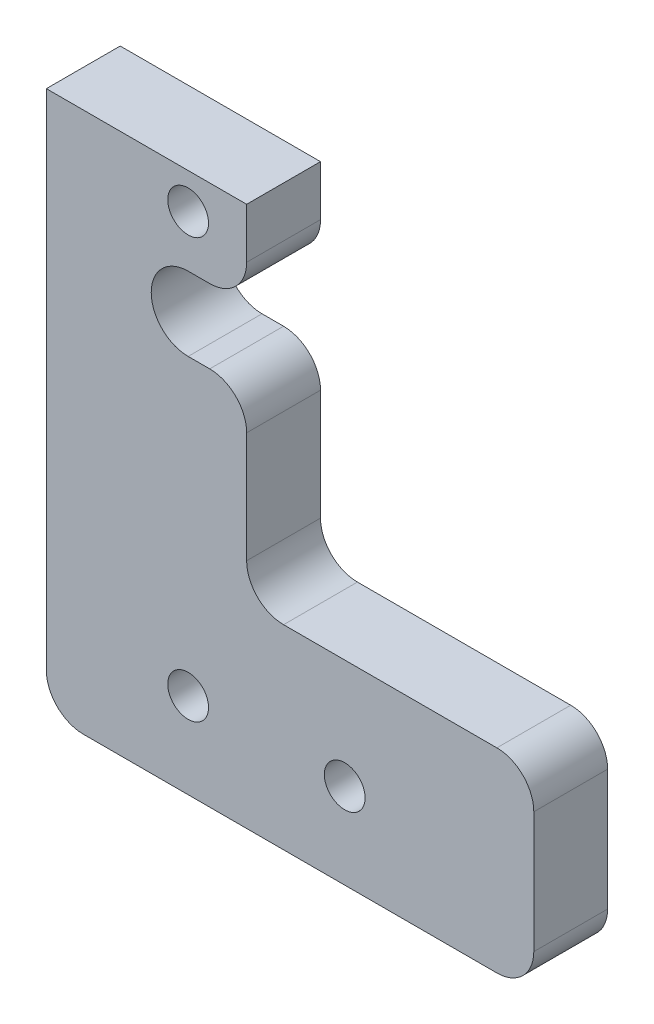
from build123d import *

# Parameters (mm, degrees)
SKETCH1_R           = 1.7526
BOSS_EXTRUDE1_DEPTH = 3.175
CUT_EXTRUDE1_DEPTH  = 40.153784867
FILLET1_R           = 3.175


with BuildPart() as part:
    # Sketch1 → Boss-Extrude1 (new, symmetric)
    with BuildSketch(Plane.XY):
        with BuildLine():
            Line((-17.2212, 29.718), (-17.2212, -13.589))
            ThreePointArc((-17.2212, -13.589), (-16.29126403, -15.83406403), (-14.0462, -16.764))
            Line((-14.0462, -16.764), (21.5138, -16.764))
            ThreePointArc((21.5138, -16.764), (23.75886403, -15.83406403), (24.6888, -13.589))
            Line((24.6888, -13.589), (24.6888, -3.175))
            ThreePointArc((24.6888, -3.175), (23.75886403, -0.92993597), (21.5138, 0))
            Line((21.5138, 0), (3.175, 0))
            ThreePointArc((3.175, 0), (0.92993597, 0.92993597), (0, 3.175))
            Line((0, 3.175), (0, 29.718))
            Line((0, 29.718), (-17.2212, 29.718))
        make_face()
        with Locations((-5.0292, 26.67)):
            Circle(SKETCH1_R, mode=Mode.SUBTRACT)
        with Locations((-5.0292, -9.398)):
            Circle(SKETCH1_R, mode=Mode.SUBTRACT)
        with Locations((8.4328, -9.398)):
            Circle(SKETCH1_R, mode=Mode.SUBTRACT)
    extrude(amount=BOSS_EXTRUDE1_DEPTH, both=True)

    # Sketch2 → Cut-Extrude1 (cut, through all)
    with BuildSketch(Plane.XY.offset(3.175)):
        with BuildLine():
            Line((-5.0292, 22.225), (24.6888, 22.225))
            Line((24.6888, 22.225), (24.6888, 15.875))
            Line((24.6888, 15.875), (-5.0292, 15.875))
            ThreePointArc((-5.0292, 15.875), (-8.2042, 19.05), (-5.0292, 22.225))
        make_face()
    extrude(amount=-CUT_EXTRUDE1_DEPTH, mode=Mode.SUBTRACT)

    # Fillet1
    fillet1_edges = [part.edges().sort_by_distance(p)[0] for p in [
        (0, 15.875, 0),
        (0, 22.225, 0),
    ]]
    fillet(fillet1_edges, radius=FILLET1_R)


solid = part.part
